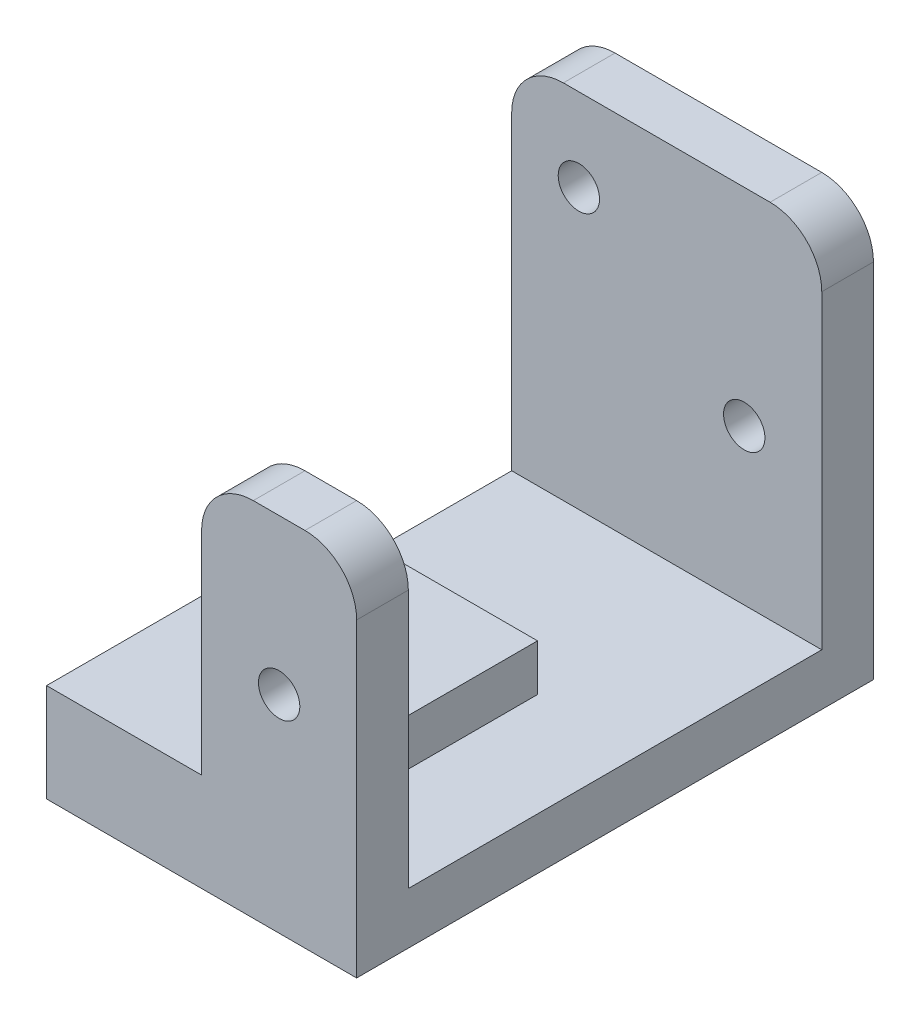
from build123d import *

# Parameters (mm, degrees)
ESQUISSE1_W             = 60
ESQUISSE1_H             = 100
BOSS_EXTRU_1_DEPTH      = 10
ESQUISSE2_W             = 30
ESQUISSE2_H             = 10
BOSS_EXTRU_2_DEPTH      = 60
ESQUISSE3_W             = 60
ESQUISSE3_H             = 10
BOSS_EXTRU_3_DEPTH      = 70
BOSS_EXTRU_4_DEPTH      = 9
ESQUISSE6_R             = 4
ENL_V_MAT_EXTRU_2_DEPTH = 142.421356237
CONG_1_R                = 10


with BuildPart() as part:
    # Esquisse1 → Boss.-Extru.1 (new body)
    with BuildSketch(Plane(origin=(0, 0, 0), x_dir=(1, 0, 0), z_dir=(0, 1, 0))):
        with Locations((30, 50)):
            Rectangle(ESQUISSE1_W, ESQUISSE1_H)
    extrude(amount=BOSS_EXTRU_1_DEPTH)

    # Esquisse2 → Boss.-Extru.2 (add)
    with BuildSketch(Plane(origin=(0, 10, 0), x_dir=(1, 0, 0), z_dir=(0, 1, 0))):
        with Locations((45, 5)):
            Rectangle(ESQUISSE2_W, ESQUISSE2_H)
    extrude(amount=BOSS_EXTRU_2_DEPTH)

    # Esquisse3 → Boss.-Extru.3 (add)
    with BuildSketch(Plane(origin=(0, 10, 0), x_dir=(1, 0, 0), z_dir=(0, 1, 0))):
        with Locations((30, 95)):
            Rectangle(ESQUISSE3_W, ESQUISSE3_H)
    extrude(amount=BOSS_EXTRU_3_DEPTH)

    # Esquisse8 → Boss.-Extru.4 (add)
    with BuildSketch(Plane(origin=(0, 10, 0), x_dir=(1, 0, 0), z_dir=(0, 1, 0))):
        Polygon((0, 0), (0, 55), (40, 55), (40, 10), (30, 10), (30, 0), align=None)
    extrude(amount=BOSS_EXTRU_4_DEPTH)

    # Esquisse6 → Enlèv. mat.-Extru.2 (cut, through all)
    with BuildSketch(Plane(origin=(0, 0, -100), x_dir=(-1, 0, 0), z_dir=(0, 0, -1))):
        with Locations((-45, 40)):
            Circle(ESQUISSE6_R)
        with Locations((-13, 64)):
            Circle(ESQUISSE6_R)
    extrude(amount=-ENL_V_MAT_EXTRU_2_DEPTH, mode=Mode.SUBTRACT)

    # Congé1
    cong_1_edges = [part.edges().sort_by_distance(p)[0] for p in [
        (0, 80, -95),
        (60, 80, -95),
        (30, 70, -5),
        (60, 70, -5),
    ]]
    fillet(cong_1_edges, radius=CONG_1_R)


solid = part.part
